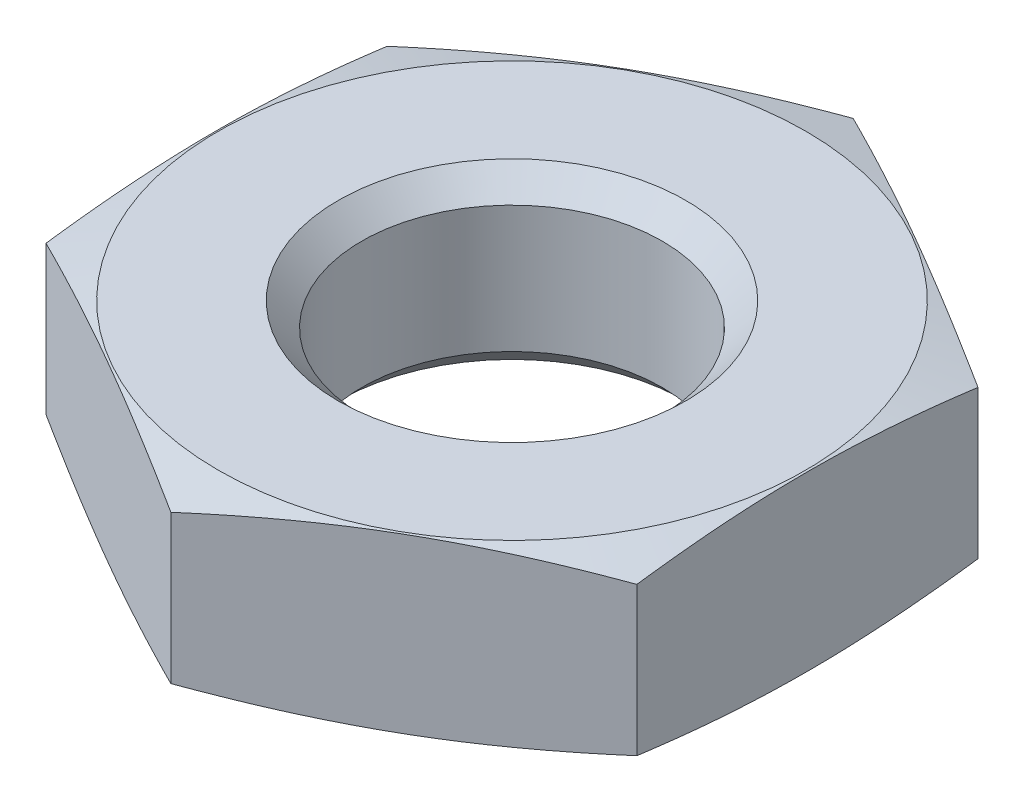
from build123d import *

# Parameters (mm, degrees)
SCHNITT_LINEAR_AUSTRAGEN1_DEPTH      = 6
SCHNITT_LINEAR_AUSTRAGEN1_DEPTH_BACK = 6
SKIZZE2_W                            = 68
SKIZZE2_H                            = 68


with BuildPart() as part:
    # Skizze1 → Rotation1 (revolve)
    with BuildSketch(Plane.XY):
        Polygon((0, 0), (8.45, 0), (17.780127019, -2.5), (8.45, -5), (0, -5), align=None)
    revolve(axis=Axis((0, -5, 0), (0, 1, 0)))

    # Skizze2 → Schnitt-Linear austragen1 (cut, two sides: drawn at the far end of the back side and taken through both)
    with BuildSketch(Plane(origin=(0, 0, 0), x_dir=(1, 0, 0), z_dir=(0, 1, 0)).offset(-SCHNITT_LINEAR_AUSTRAGEN1_DEPTH_BACK)):
        Rectangle(SKIZZE2_W, SKIZZE2_H)
        Polygon((-8.5, -4.907477288), (0, -9.814954576), (8.5, -4.907477288), (8.5, 4.907477288), (0, 9.814954576), (-8.5, 4.907477288), align=None, mode=Mode.SUBTRACT)
    extrude(amount=SCHNITT_LINEAR_AUSTRAGEN1_DEPTH + SCHNITT_LINEAR_AUSTRAGEN1_DEPTH_BACK, mode=Mode.SUBTRACT)

    # Skizze3 → Schnitt-Rotation1 (revolve, cut)
    with BuildSketch(Plane.XY):
        Polygon((0, 0), (5, 0), (4.3235, -0.6765), (4.3235, -4.3235), (5, -5), (0, -5), align=None)
    revolve(axis=Axis((0, -5, 0), (0, 1, 0)), mode=Mode.SUBTRACT)


solid = part.part
